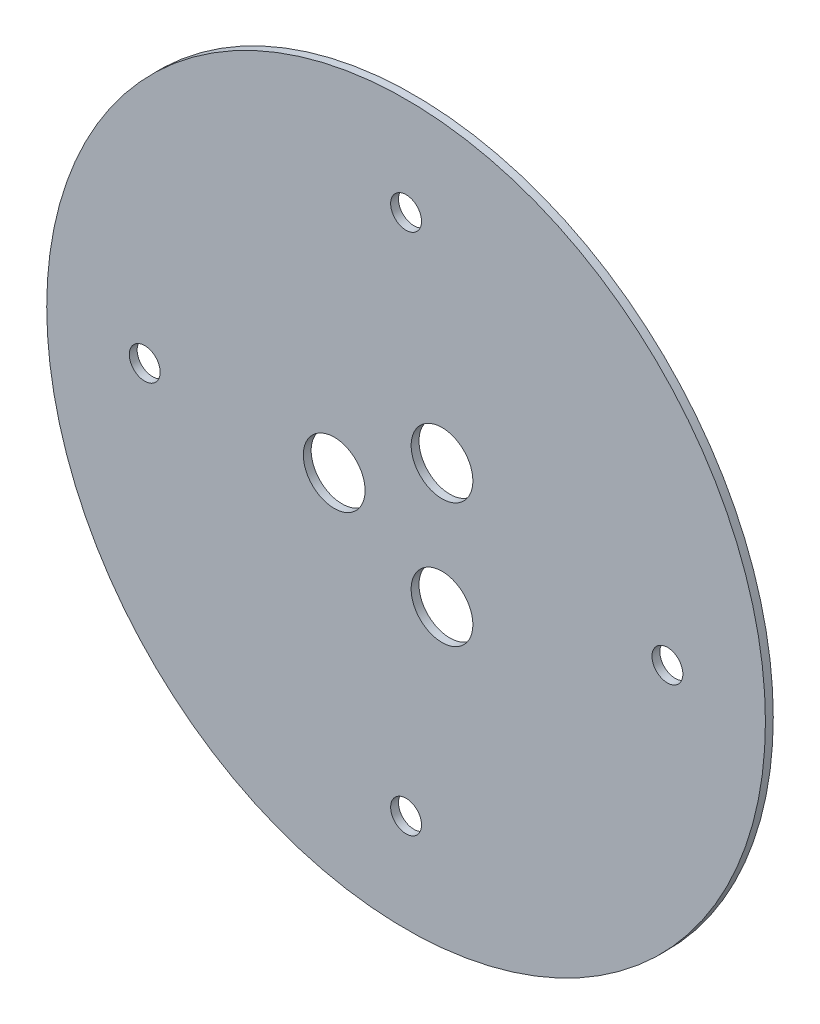
from build123d import *

# Parameters (mm, degrees)
SKETCH1_R           = 69.85
BOSS_EXTRUDE1_DEPTH = 1.524
SKETCH2_R           = 6
CUT_EXTRUDE1_DEPTH  = 2
CUT_EXTRUDE2_REACH  = 100.795
SKETCH3_R           = 3
CIRPATTERN1_COUNT   = 4


with BuildPart() as part:
    # Sketch1 → Boss-Extrude1 (new body)
    with BuildSketch(Plane.XY):
        with Locations(Location((0, 0, 0), (0, 0, 180))):
            Circle(SKETCH1_R)
    extrude(amount=BOSS_EXTRUDE1_DEPTH)

    # Sketch2 → Cut-Extrude1 (cut)
    with BuildSketch(Plane.XY.offset(1.524)):
        with Locations((-13.97, 0)):
            Circle(SKETCH2_R)
        with Locations((6.985, 12.098374891)):
            Circle(SKETCH2_R)
        with Locations((6.985, -12.098374891)):
            Circle(SKETCH2_R)
    extrude(amount=-CUT_EXTRUDE1_DEPTH, mode=Mode.SUBTRACT)

    # Sketch3 → Cut-Extrude2 (cut, up to next)
    with BuildSketch(Plane.XY.offset(1.524), mode=Mode.PRIVATE) as cut_extrude2_sk1:
        with Locations((50.8, 0)):
            Circle(SKETCH3_R)
    cut_extrude2_tool1 = extrude(cut_extrude2_sk1.sketch, amount=-CUT_EXTRUDE2_REACH, mode=Mode.PRIVATE) & part.part
    cut_extrude2 = cut_extrude2_tool1.solids().sort_by_distance((50.8, 0, 1.524))[0]
    add(cut_extrude2, mode=Mode.SUBTRACT)

    # CirPattern1: Cut-Extrude2 ×4 about axis
    cirpattern1_axis = Axis((0, 0, 0), (0, 0, 1))
    for i in range(1, CIRPATTERN1_COUNT):
        add(cut_extrude2.rotate(cirpattern1_axis, i * 360 / CIRPATTERN1_COUNT), mode=Mode.SUBTRACT)


solid = part.part
